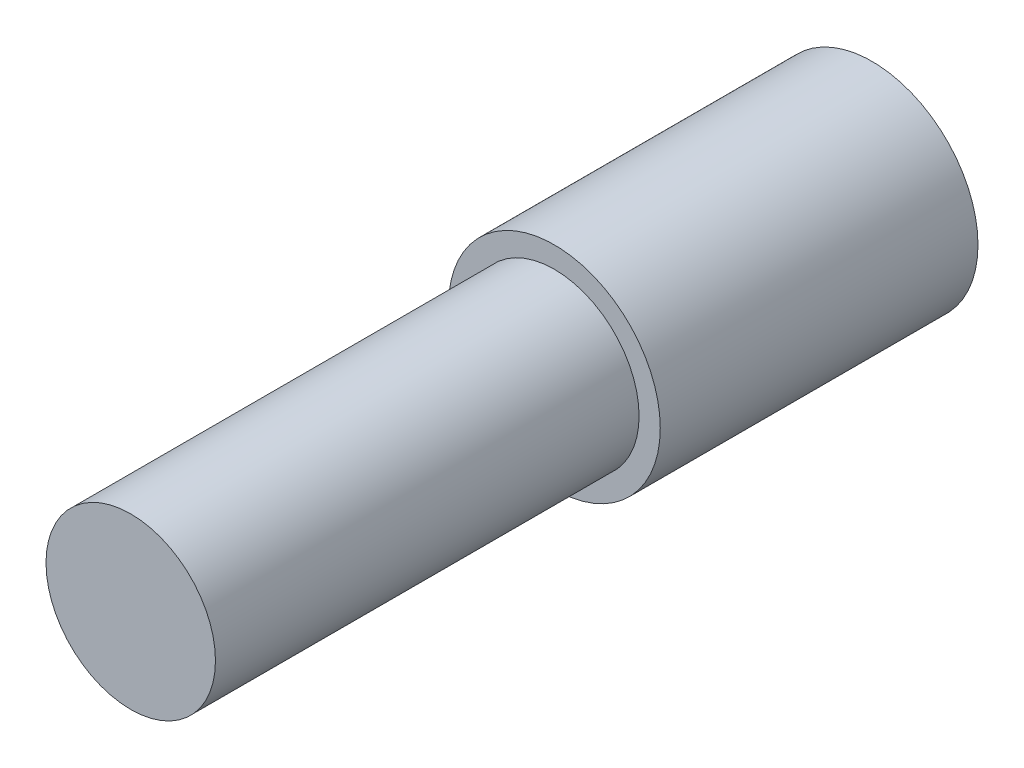
from build123d import *

# Parameters (mm, degrees)
SKETCH1_R           = 5
BOSS_EXTRUDE1_DEPTH = 15
SKETCH2_R           = 4
BOSS_EXTRUDE2_DEPTH = 20


with BuildPart() as part:
    # Sketch1 → Boss-Extrude1 (new body)
    with BuildSketch(Plane.XY):
        Circle(SKETCH1_R)
    extrude(amount=BOSS_EXTRUDE1_DEPTH)

    # Sketch2 → Boss-Extrude2 (add)
    with BuildSketch(Plane.XY.offset(15)):
        Circle(SKETCH2_R)
    extrude(amount=BOSS_EXTRUDE2_DEPTH)


solid = part.part
